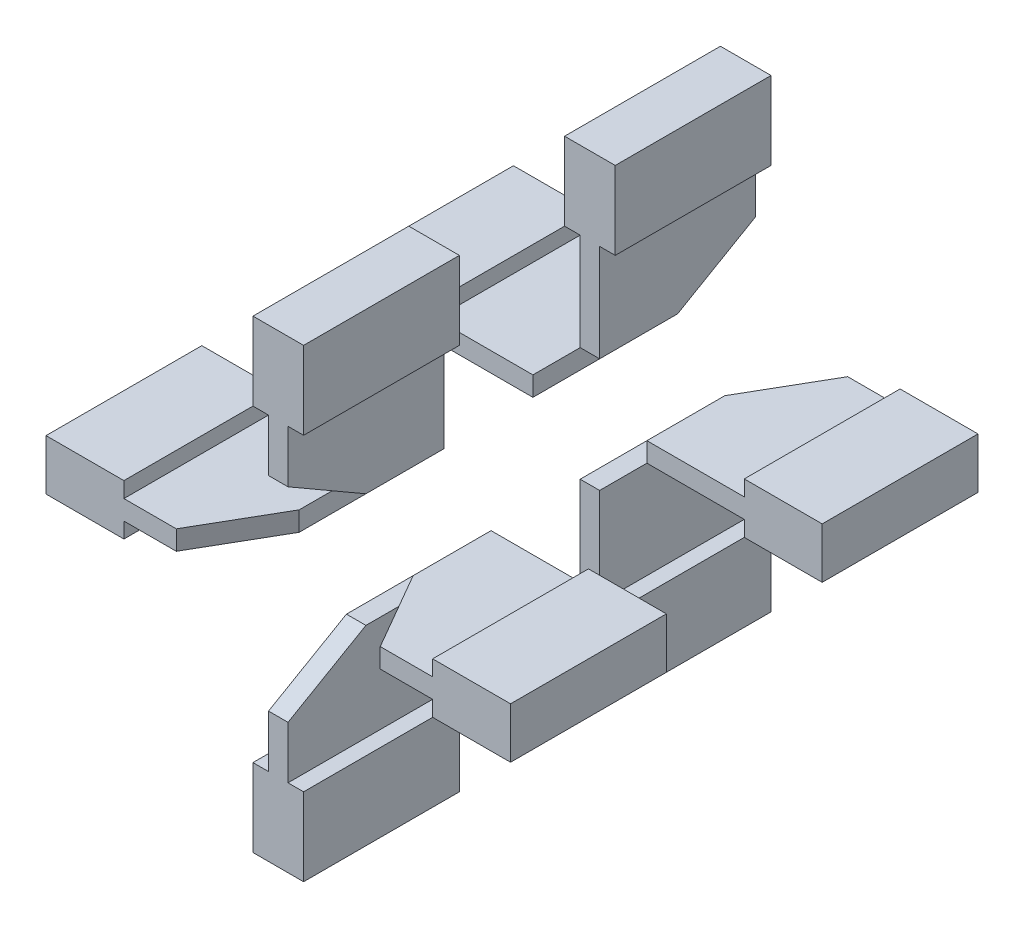
from build123d import *

# Parameters (mm, degrees)
BOSS_EXTRUDE1_DEPTH = 40
CUT_EXTRUDE1_DEPTH  = 97.757224702
CIRPATTERN1_COUNT   = 4


with BuildPart() as part:
    # Sketch4 → Boss-Extrude1 (new body)
    with BuildSketch(Plane.XY.offset(20)):
        Polygon((-2.5, 30.372146925), (2.5, 30.372146925), (6.5, 30.372146925), (6.5, 50.372146925), (2.5, 50.372146925), (2.5, 75.372146925), (-2.5, 75.372146925), (-2.5, 50.372146925), (-6.5, 50.372146925), (-6.5, 30.372146925), align=None)
    extrude(amount=BOSS_EXTRUDE1_DEPTH)

    # Sketch7 → Cut-Extrude1 (cut, through all)
    with BuildSketch(Plane(origin=(2.5, 0, 0), x_dir=(0, 0, -1), z_dir=(1, 0, 0))):
        Polygon((-60, 63.825141541), (-60, 75.372146925), (-40, 75.372146925), align=None)
    extrude(amount=-CUT_EXTRUDE1_DEPTH, mode=Mode.SUBTRACT)


with BuildPart() as cirpattern1_1:
    # CirPattern1: pattern copy
    add(part.part.rotate(Axis((0, 90, 0), (0, 0, 1)), 1 * 360 / CIRPATTERN1_COUNT))


with BuildPart() as cirpattern1_2:
    # CirPattern1: pattern copy
    add(part.part.rotate(Axis((0, 90, 0), (0, 0, 1)), 2 * 360 / CIRPATTERN1_COUNT))


with BuildPart() as cirpattern1_3:
    # CirPattern1: pattern copy
    add(part.part.rotate(Axis((0, 90, 0), (0, 0, 1)), 3 * 360 / CIRPATTERN1_COUNT))


with BuildPart() as body_5:
    # Mirror8: mirrored copy
    add(cirpattern1_1.part.mirror(Plane(origin=(0, 0, 0), x_dir=(1, 0, 0), z_dir=(0, 0, -1))))


with BuildPart() as body_6:
    # Mirror8 2: mirrored copy
    add(part.part.mirror(Plane(origin=(0, 0, 0), x_dir=(1, 0, 0), z_dir=(0, 0, -1))))


with BuildPart() as body_7:
    # Mirror8 3: mirrored copy
    add(cirpattern1_3.part.mirror(Plane(origin=(0, 0, 0), x_dir=(1, 0, 0), z_dir=(0, 0, -1))))


with BuildPart() as body_8:
    # Mirror8 4: mirrored copy
    add(cirpattern1_2.part.mirror(Plane(origin=(0, 0, 0), x_dir=(1, 0, 0), z_dir=(0, 0, -1))))


solid = Compound([part.part, cirpattern1_1.part, cirpattern1_2.part, cirpattern1_3.part, body_5.part, body_6.part, body_7.part, body_8.part])
